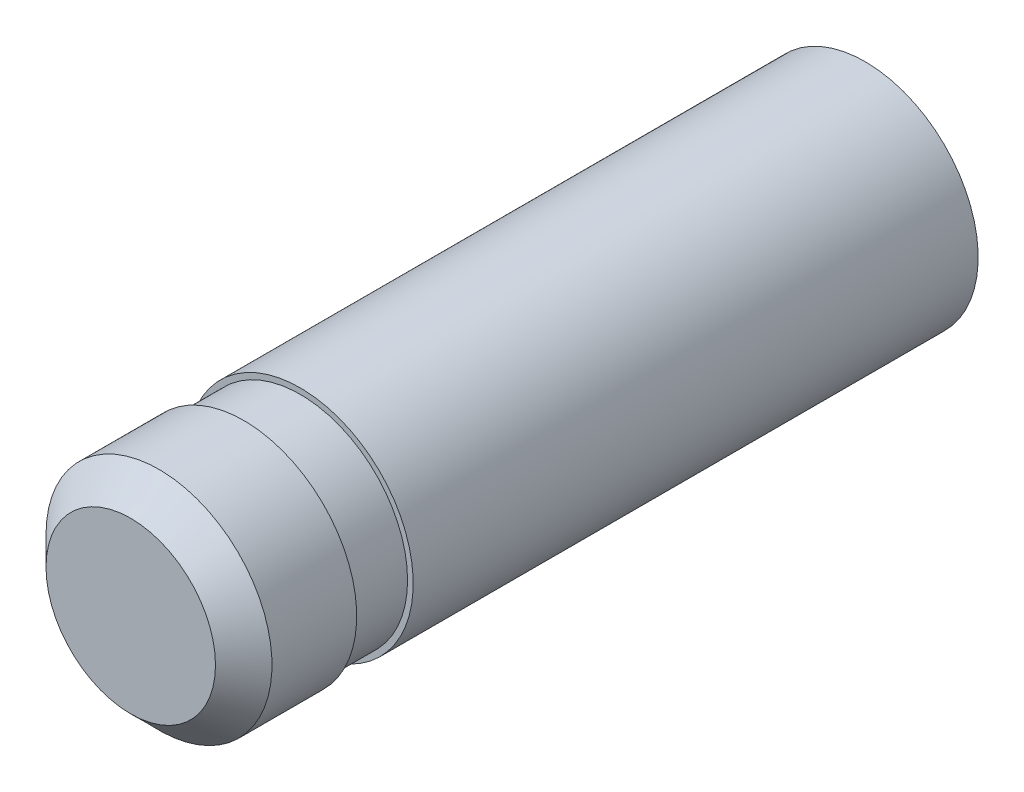
from build123d import *

# Parameters (mm, degrees)
SKETCH1_R           = 2
BOSS_EXTRUDE1_DEPTH = 6.5
CUT_EXTRUDE1_START  = -2
SKETCH2_R           = 2
SKETCH2_R_2         = 1.9
CUT_EXTRUDE1_DEPTH  = 1
CHAMFER1_SIZE       = 0.5


with BuildPart() as part:
    # Sketch1 → Boss-Extrude1 (new, symmetric)
    with BuildSketch(Plane.XY):
        with Locations(Location((0, 0, 0), (0, 0, 180))):
            Circle(SKETCH1_R)
    extrude(amount=BOSS_EXTRUDE1_DEPTH, both=True)

    # Sketch2 → Cut-Extrude1 (cut)
    with BuildSketch(Plane.XY.offset(6.5).offset(CUT_EXTRUDE1_START)):
        with Locations(Location((0, 0, 0), (0, 0, 180))):
            Circle(SKETCH2_R)
        Circle(SKETCH2_R_2, mode=Mode.SUBTRACT)
    extrude(amount=-CUT_EXTRUDE1_DEPTH, mode=Mode.SUBTRACT)

    # Chamfer1
    chamfer1_edges = [part.edges().sort_by_distance(p)[0] for p in [
        (2, 0, 6.5),
    ]]
    chamfer(chamfer1_edges, length=CHAMFER1_SIZE)


solid = part.part
